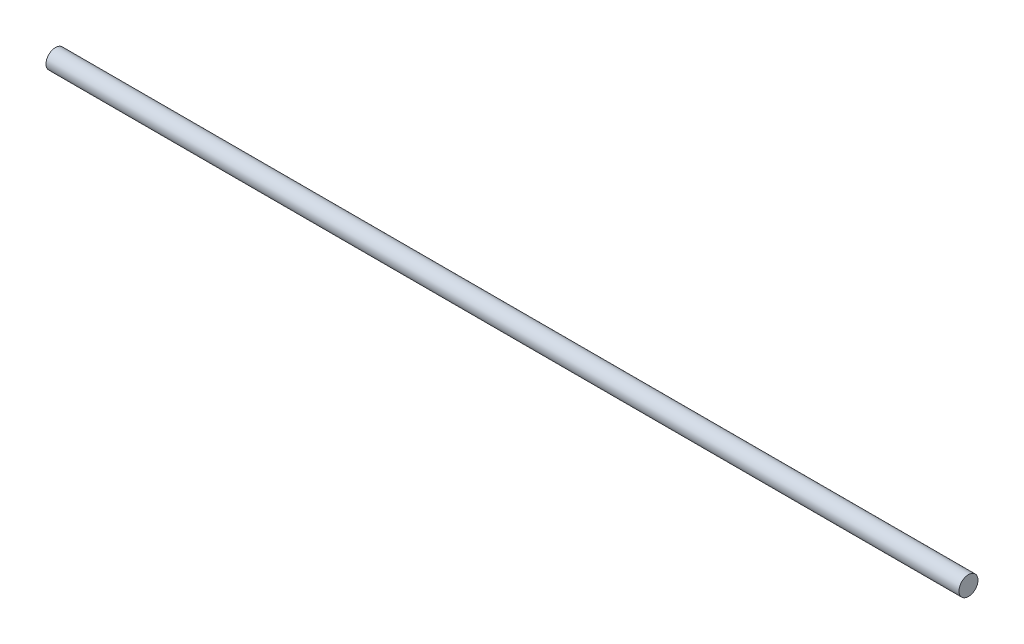
from build123d import *

# Parameters (mm, degrees)
BOSS_EXTRUDE2_DEPTH      = 182.88
BOSS_EXTRUDE2_DEPTH_BACK = 182.88
SKETCH4_R                = 3.81


with BuildPart() as part:
    # Sketch4 → Boss-Extrude2 (new, two sides: drawn at the far end of the back side and taken through both)
    with BuildSketch(Plane(origin=(0, 0, 0), x_dir=(0, 0, -1), z_dir=(1, 0, 0)).offset(-BOSS_EXTRUDE2_DEPTH_BACK)):
        Circle(SKETCH4_R)
    extrude(amount=BOSS_EXTRUDE2_DEPTH + BOSS_EXTRUDE2_DEPTH_BACK)


solid = part.part
